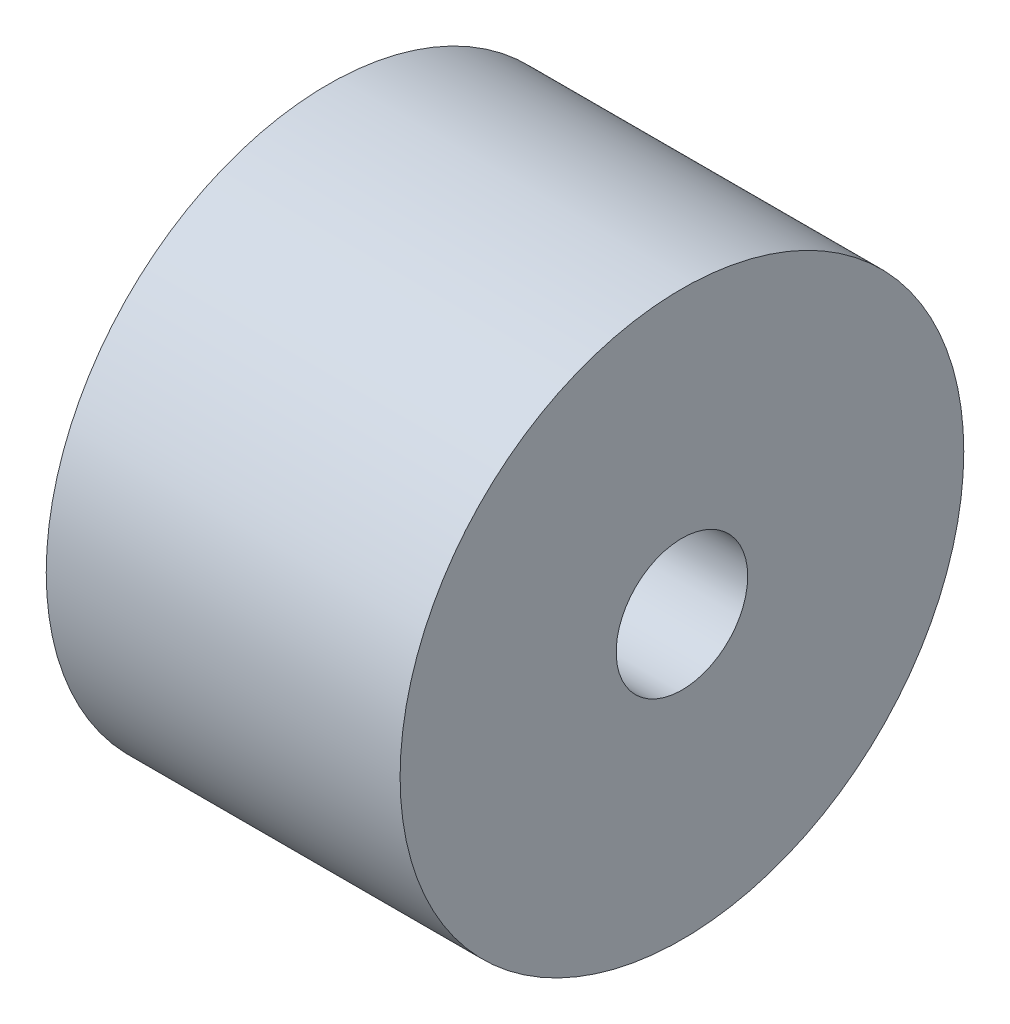
from build123d import *

# Parameters (mm, degrees)
SKETCH1_R           = 9
SKETCH1_R_2         = 2.1
BOSS_EXTRUDE1_DEPTH = 11.3


with BuildPart() as part:
    # Sketch1 → Boss-Extrude1 (new body)
    with BuildSketch(Plane(origin=(0, 0, 0), x_dir=(0, 0, -1), z_dir=(1, 0, 0))):
        Circle(SKETCH1_R)
        Circle(SKETCH1_R_2, mode=Mode.SUBTRACT)
    extrude(amount=BOSS_EXTRUDE1_DEPTH)


solid = part.part
